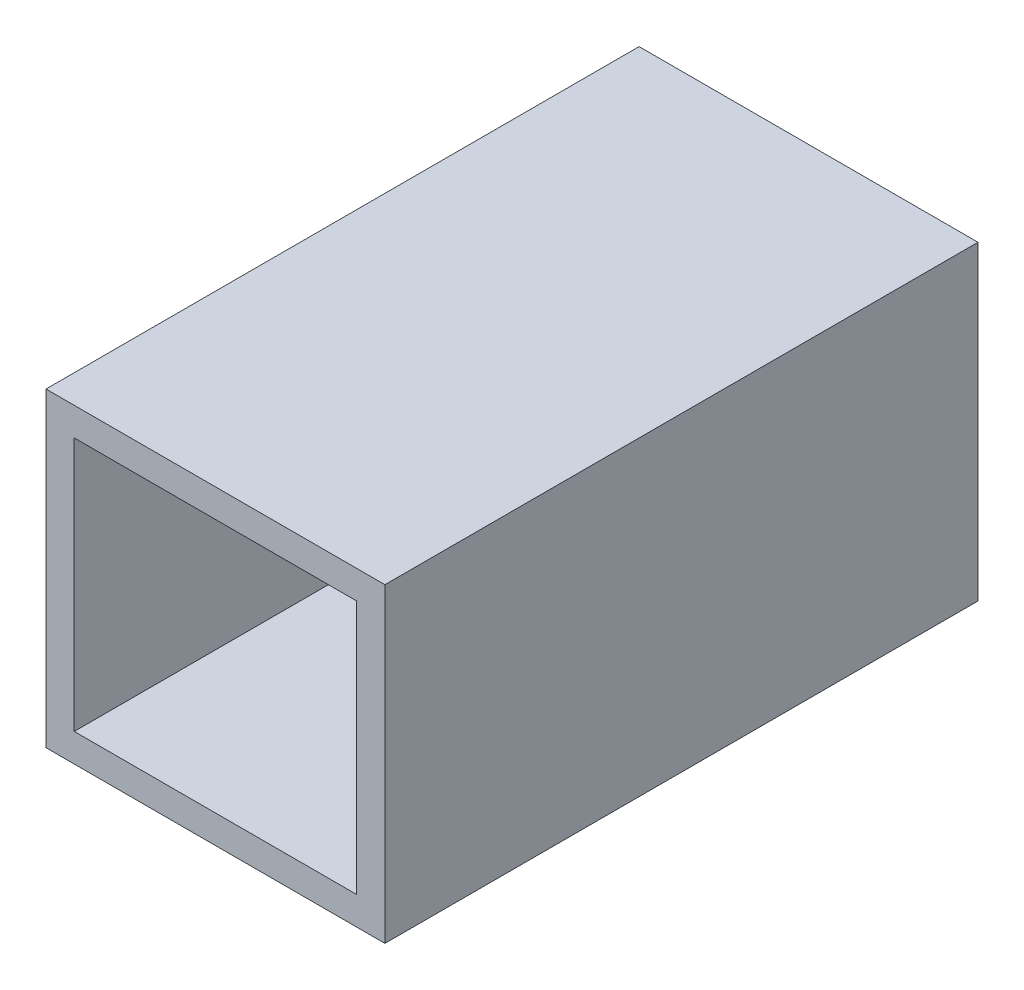
from build123d import *

# Parameters (mm, degrees)
SKETCH3_W           = 60
SKETCH3_H           = 55
SKETCH3_W_2         = 50
SKETCH3_H_2         = 45
BOSS_EXTRUDE1_DEPTH = 105
SKETCH6_W           = 50
SKETCH6_H           = 5
BOSS_EXTRUDE3_DEPTH = 10
SKETCH7_R           = 2.5
BOSS_EXTRUDE4_DEPTH = 10


with BuildPart() as part:
    # Sketch3 → Boss-Extrude1 (new body)
    with BuildSketch(Plane.XY):
        Rectangle(SKETCH3_W, SKETCH3_H)
        Rectangle(SKETCH3_W_2, SKETCH3_H_2, mode=Mode.SUBTRACT)
    extrude(amount=-BOSS_EXTRUDE1_DEPTH)

    # Sketch6 → Boss-Extrude3 (add)
    with BuildSketch(Plane(origin=(0, -22.5, 0), x_dir=(1, 0, 0), z_dir=(0, 1, 0))):
        with Locations((0, 102.5)):
            Rectangle(SKETCH6_W, SKETCH6_H)
    extrude(amount=BOSS_EXTRUDE3_DEPTH)

    # Sketch7 → Boss-Extrude4 (add)
    with BuildSketch(Plane.XZ.offset(27.5)):
        with Locations((0, -52.5)):
            Circle(SKETCH7_R)
    extrude(amount=BOSS_EXTRUDE4_DEPTH)


solid = part.part
